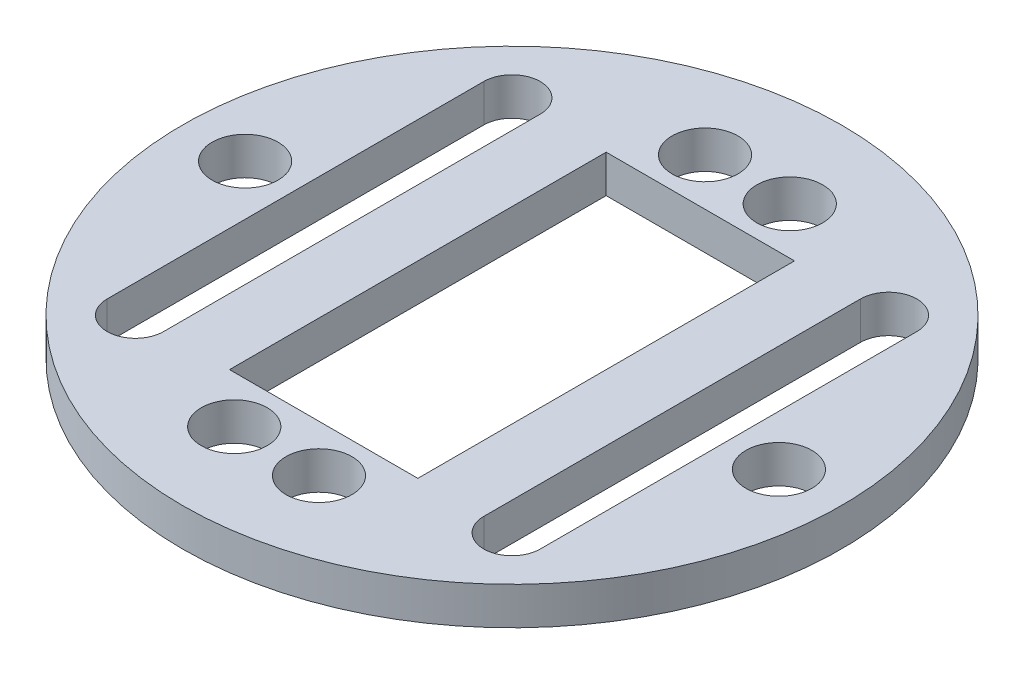
from build123d import *

# Parameters (mm, degrees)
SKETCH1_R           = 35
BOSS_EXTRUDE1_DEPTH = 4
SKETCH2_R           = 3.5
SKETCH2_W           = 20
SKETCH2_H           = 40
CUT_EXTRUDE1_DEPTH  = 5


with BuildPart() as part:
    # Sketch1 → Boss-Extrude1 (new body)
    with BuildSketch(Plane(origin=(0, 0, 0), x_dir=(1, 0, 0), z_dir=(0, 1, 0))):
        with Locations(Location((0, 0, 0), (0, 0, 270))):
            Circle(SKETCH1_R)
    extrude(amount=BOSS_EXTRUDE1_DEPTH)

    # Sketch2 → Cut-Extrude1 (cut)
    with BuildSketch(Plane(origin=(0, 0, 0), x_dir=(1, 0, 0), z_dir=(0, 1, 0))):
        with Locations(Location((-4.5, 25, 0), (0, 0, 270))):
            Circle(SKETCH2_R)
        with Locations(Location((4.5, 25, 0), (0, 0, 90))):
            Circle(SKETCH2_R)
        with Locations(Location((4.5, -25, 0), (0, 0, 270))):
            Circle(SKETCH2_R)
        with Locations(Location((-4.5, -25, 0), (0, 0, 90))):
            Circle(SKETCH2_R)
        with Locations(Location((-28.346706054, 0, 0), (0, 0, 270))):
            Circle(SKETCH2_R)
        with Locations(Location((28.346706054, 0, 0), (0, 0, 90))):
            Circle(SKETCH2_R)
        Rectangle(SKETCH2_W, SKETCH2_H)
        with BuildLine():
            Line((-17, 20), (-17, -20))
            ThreePointArc((-17, -20), (-20, -23), (-23, -20))
            Line((-23, -20), (-23, 20))
            ThreePointArc((-23, 20), (-20, 23), (-17, 20))
        make_face()
        with BuildLine():
            Line((17, 20), (17, -20))
            ThreePointArc((17, -20), (20, -23), (23, -20))
            Line((23, -20), (23, 20))
            ThreePointArc((23, 20), (20, 23), (17, 20))
        make_face()
    extrude(amount=CUT_EXTRUDE1_DEPTH, mode=Mode.SUBTRACT)


solid = part.part
